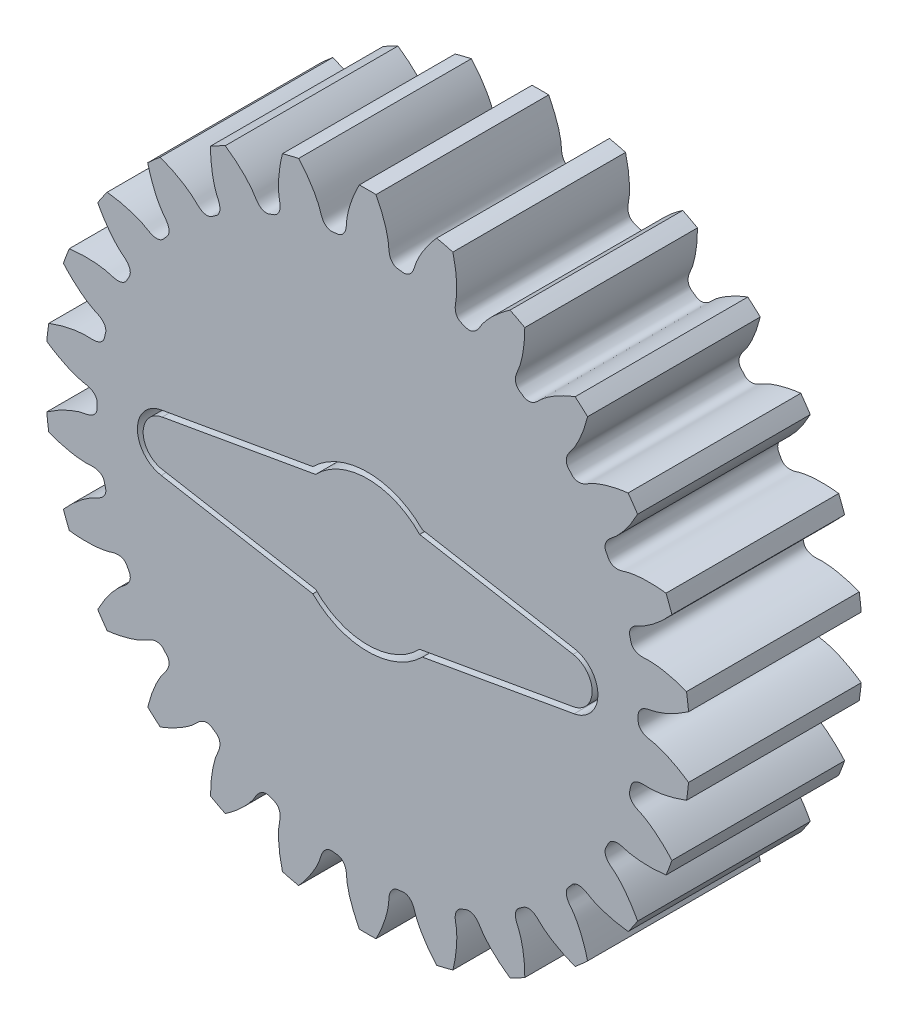
from build123d import *

# Parameters (mm, degrees)
SKETCH_308_W               = 15
SKETCH_308_H               = 27.999999579
CUT_EXTRUDE_515_DEPTH      = 7.5
PATTERN_CIRCULAR_565_COUNT = 26
SKETCH5_R                  = 1.5
EXTRUDE2_DEPTH             = 43.260484131
EXTRUDE3_DEPTH             = 2.5
EXTRUDE4_DEPTH             = 2.5


with BuildPart() as part:
    # Sketch 308 → Revolve 371 (revolve)
    with BuildSketch(Plane(origin=(0, 0, 0), x_dir=(0, 0, -1), z_dir=(1, 0, 0)), mode=Mode.PRIVATE) as revolve_371_sk:
        with Locations((0, 13.99999979)):
            Rectangle(SKETCH_308_W, SKETCH_308_H)
    revolve(revolve_371_sk.sketch.rotate(Axis((0, 0, 0), (0, 0, -1)), 90), axis=Axis((0, 0, 0), (0, 0, -1)))

    # Sketch 414 → Cut-Extrude 515 (cut, symmetric)
    with BuildSketch(Plane.XY):
        with BuildLine():
            ThreePointArc((27.967931097, 2.721177403), (28.099999578, 0), (27.967931097, -2.721177403))
            add(Edge.make_bspline(
                [(27.967931097, -2.721177403), (27.763754051, -2.577368906), (27.45988226, -2.375317635), (27.054718448, -2.130765319), (26.771509076, -1.970609362), (26.501301853, -1.827769559), (26.244837865, -1.701370926), (26.002818782, -1.590510368), (25.775905852, -1.494258757), (25.564719071, -1.411662129), (25.369836074, -1.341744195), (25.191792165, -1.283505096), (25.031076951, -1.235932279), (24.888141941, -1.197973136), (24.763374398, -1.168626354), (24.601482522, -1.135163276), (24.461000613, -1.114665459), (24.3400298, -1.085169118), (24.285329772, -1.070385484), (24.231808297, -1.054217742), (24.179372559, -1.036618392), (24.127928615, -1.017455788), (24.077371517, -0.996577599), (24.027590303, -0.973783462), (23.978471643, -0.948819225), (23.929907997, -0.921363004), (23.881811039, -0.891011365), (23.834133426, -0.857264848), (23.786902383, -0.819516465), (23.740269036, -0.777049029), (23.694576301, -0.729051801), (23.6504434, -0.67467254), (23.608854908, -0.613124585), (23.571221179, -0.543867316), (23.539365223, -0.466847843), (23.515340187, -0.38278444), (23.502044213, -0.298708372), (23.496372243, -0.170483459), (23.502685726, 0), (23.496372243, 0.170483459), (23.502044213, 0.298708372), (23.515340187, 0.38278444), (23.539365223, 0.466847843), (23.571221179, 0.543867316), (23.608854908, 0.613124585), (23.6504434, 0.67467254), (23.694576301, 0.729051801), (23.740269036, 0.777049029), (23.786902383, 0.819516465), (23.834133426, 0.857264848), (23.881811039, 0.891011365), (23.929907997, 0.921363004), (23.978471643, 0.948819225), (24.027590303, 0.973783462), (24.077371517, 0.996577599), (24.127928615, 1.017455788), (24.179372559, 1.036618392), (24.231808297, 1.054217742), (24.285329772, 1.070385484), (24.3400298, 1.085169118), (24.461000613, 1.114665459), (24.601482522, 1.135163276), (24.763374398, 1.168626354), (24.888141941, 1.197973136), (25.031076951, 1.235932279), (25.191792165, 1.283505096), (25.369836074, 1.341744195), (25.564719071, 1.411662129), (25.775905852, 1.494258757), (26.002818782, 1.590510368), (26.244837865, 1.701370926), (26.501301853, 1.827769559), (26.771509076, 1.970609362), (27.054718448, 2.130765319), (27.45988226, 2.375317635), (27.763754051, 2.577368906), (27.967931097, 2.721177403)],
                knots=[0, 0, 0, 0, 0.067642351, 0.098793434, 0.128164455, 0.155755414, 0.181566311, 0.205597146, 0.22784792, 0.248318632, 0.267009282, 0.28391987, 0.299050396, 0.312400861, 0.323971263, 0.333761605, 0.357173802, 0.362366391, 0.367477745, 0.372520049, 0.377507462, 0.38245648, 0.387386356, 0.39231959, 0.397282469, 0.402305638, 0.407424635, 0.412680294, 0.418118795, 0.423791042, 0.429750853, 0.4360513, 0.442738456, 0.449842153, 0.457364385, 0.465267868, 0.473469458, 0.480354235, 0.5, 0.519645765, 0.526530542, 0.534732132, 0.542635615, 0.550157847, 0.557261544, 0.5639487, 0.570249147, 0.576208958, 0.581881205, 0.587319706, 0.592575365, 0.597694362, 0.602717531, 0.60768041, 0.612613644, 0.61754352, 0.622492538, 0.627479951, 0.632522255, 0.637633609, 0.642826198, 0.666238395, 0.676028737, 0.687599139, 0.700949604, 0.71608013, 0.732990718, 0.751681368, 0.77215208, 0.794402854, 0.818433689, 0.844244586, 0.871835545, 0.901206566, 0.932357649, 1, 1, 1, 1], degree=3))
        make_face()
    cut_extrude_515 = extrude(amount=CUT_EXTRUDE_515_DEPTH, both=True, mode=Mode.SUBTRACT)

    # Pattern Circular 565: Cut-Extrude 515 ×26 about axis
    pattern_circular_565_axis = Axis((0, 0, 55), (0, 0, -1))
    for i in range(1, PATTERN_CIRCULAR_565_COUNT):
        add(cut_extrude_515.rotate(pattern_circular_565_axis, i * 360 / PATTERN_CIRCULAR_565_COUNT), mode=Mode.SUBTRACT)

    # Sketch5 → Extrude2 (cut, through all)
    with BuildSketch(Plane.XY.offset(7.5)):
        Circle(SKETCH5_R)
    extrude(amount=-EXTRUDE2_DEPTH, mode=Mode.SUBTRACT)

    # Sketch6 → Extrude3 (cut)
    with BuildSketch(Plane.XY.offset(7.5)):
        with BuildLine():
            Line((17.934120444, -2.462019383), (4.761141273, -4.784771027))
            ThreePointArc((4.761141273, -4.784771027), (0, -6.75), (-4.761141273, -4.784771027))
            Line((-4.761141273, -4.784771027), (-17.934120444, -2.462019383))
            ThreePointArc((-17.934120444, -2.462019383), (-20, 0), (-17.934120444, 2.462019383))
            Line((-17.934120444, 2.462019383), (-4.761141273, 4.784771027))
            ThreePointArc((-4.761141273, 4.784771027), (0, 6.75), (4.761141273, 4.784771027))
            Line((4.761141273, 4.784771027), (17.934120444, 2.462019383))
            ThreePointArc((17.934120444, 2.462019383), (20, 0), (17.934120444, -2.462019383))
        make_face()
    extrude(amount=-EXTRUDE3_DEPTH, mode=Mode.SUBTRACT)

    # Sketch8 → Extrude4 (add)
    with BuildSketch(Plane.XY.offset(5)):
        with BuildLine():
            Line((-17.847296355, -1.969615506), (-4.516452934, -4.320202877))
            ThreePointArc((-4.516452934, -4.320202877), (0, -6.25), (4.516452934, -4.320202877))
            Line((4.516452934, -4.320202877), (17.847296355, -1.969615506))
            ThreePointArc((17.847296355, -1.969615506), (19.5, 0), (17.847296355, 1.969615506))
            Line((17.847296355, 1.969615506), (4.516452934, 4.320202877))
            ThreePointArc((4.516452934, 4.320202877), (0, 6.25), (-4.516452934, 4.320202877))
            Line((-4.516452934, 4.320202877), (-17.847296355, 1.969615506))
            ThreePointArc((-17.847296355, 1.969615506), (-19.5, 0), (-17.847296355, -1.969615506))
        make_face()
    extrude(amount=EXTRUDE4_DEPTH)


solid = part.part
